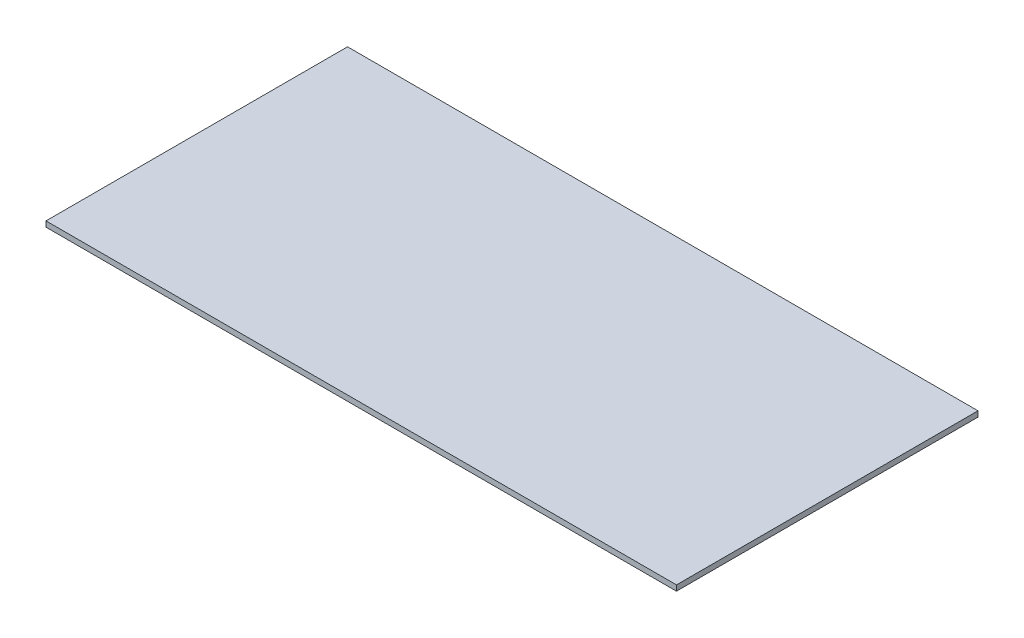
from build123d import *

# Parameters (mm, degrees)
SKETCH1_W           = 584.2
SKETCH1_H           = 279.4
BOSS_EXTRUDE1_DEPTH = 5.08


with BuildPart() as part:
    # Sketch1 → Boss-Extrude1 (new body)
    with BuildSketch(Plane(origin=(0, 0, 0), x_dir=(1, 0, 0), z_dir=(0, 1, 0))):
        with Locations((292.1, 139.7)):
            Rectangle(SKETCH1_W, SKETCH1_H)
    extrude(amount=BOSS_EXTRUDE1_DEPTH)


solid = part.part
